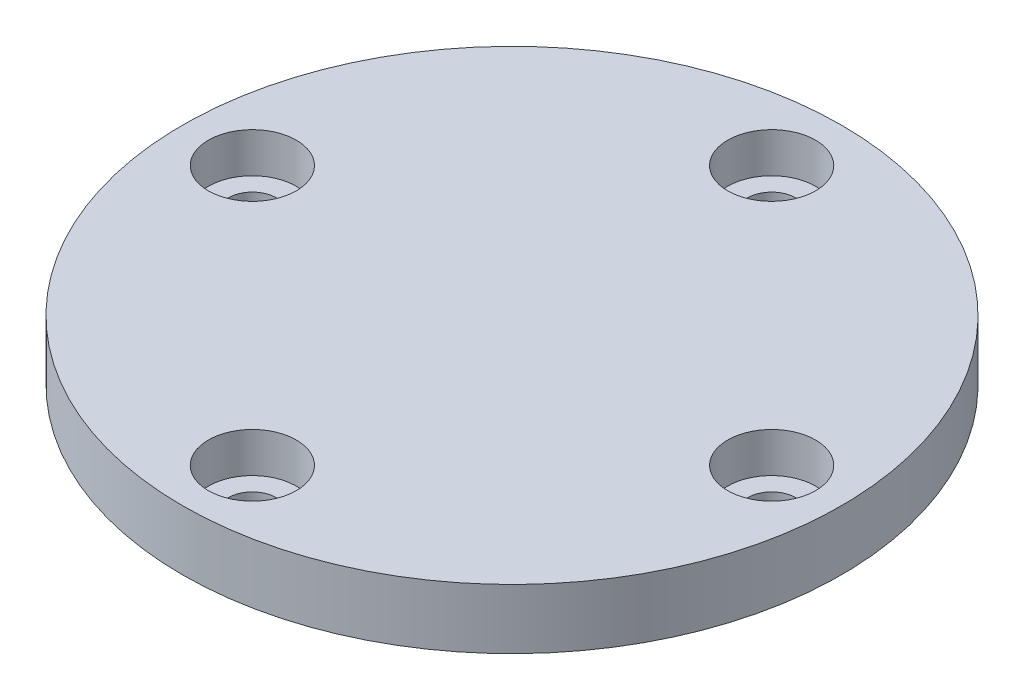
from build123d import *

# Parameters (mm, degrees)
SKETCH1_R                      = 16.5
BOSS_EXTRUDE1_DEPTH            = 3
CBORE_FOR_M2_SHCS1_D           = 2.4
CBORE_FOR_M2_SHCS1_CBORE_D     = 4.4
CBORE_FOR_M2_SHCS1_CBORE_DEPTH = 2
CIRPATTERN1_COUNT              = 4


with BuildPart() as part:
    # Sketch1 → Boss-Extrude1 (new body)
    with BuildSketch(Plane(origin=(0, 0, 0), x_dir=(1, 0, 0), z_dir=(0, 1, 0))):
        with Locations(Location((0, 0, 0), (0, 0, 270))):
            Circle(SKETCH1_R)
    extrude(amount=BOSS_EXTRUDE1_DEPTH)

    # CBORE for M2 SHCS1 (through all)
    with Locations(Plane(origin=(0, 3, 0), x_dir=(1, 0, 0), z_dir=(0, 1, 0))):
        with Locations((-13, 0)):
            cbore_for_m2_shcs1 = CounterBoreHole(CBORE_FOR_M2_SHCS1_D / 2, CBORE_FOR_M2_SHCS1_CBORE_D / 2, CBORE_FOR_M2_SHCS1_CBORE_DEPTH)

    # CirPattern1: CBORE for M2 SHCS1 ×4 about axis
    cirpattern1_axis = Axis((0, 0, 0), (0, 1, 0))
    for i in range(1, CIRPATTERN1_COUNT):
        add(cbore_for_m2_shcs1.rotate(cirpattern1_axis, i * 360 / CIRPATTERN1_COUNT), mode=Mode.SUBTRACT)


solid = part.part
